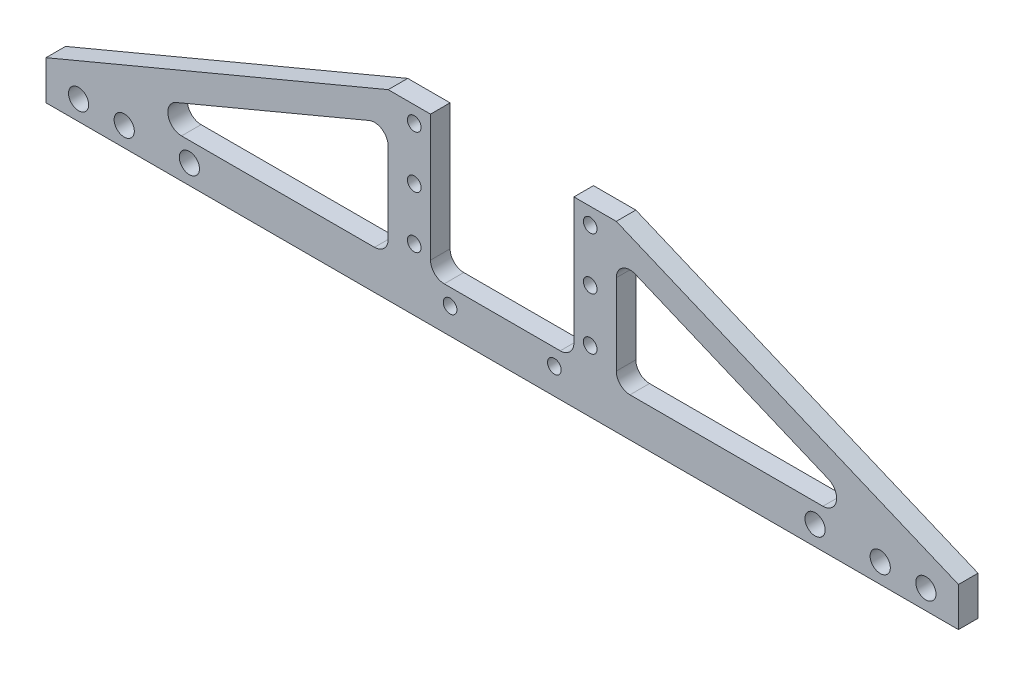
from build123d import *

# Parameters (mm, degrees)
SKETCH_1_R          = 1.05
SKETCH_1_R_2        = 1.55
EXTRUDE_1_DEPTH     = 3
SKETCH_2_R          = 1.55
CUT_EXTRUDE_1_DEPTH = 3


with BuildPart() as part:
    # ｽｹｯﾁ1 → ﾎﾞｽ - 押し出し1 (new body)
    with BuildSketch(Plane.XY):
        with BuildLine():
            Line((-11, 4.6), (-11, 24))
            Line((-11, 24), (-17.5, 24))
            Line((-17.5, 24), (-70, 2))
            Line((-70, 2), (-70, -4))
            Line((-70, -4), (-17.5, -4))
            Line((-17.5, -4), (17.5, -4))
            Line((17.5, -4), (70, -4))
            Line((70, -4), (70, 2))
            Line((70, 2), (17.5, 24))
            Line((17.5, 24), (11, 24))
            Line((11, 24), (11, 4.6))
            ThreePointArc((11, 4.6), (10.38492424, 3.11507576), (8.9, 2.5))
            Line((8.9, 2.5), (-8.9, 2.5))
            ThreePointArc((-8.9, 2.5), (-10.38492424, 3.11507576), (-11, 4.6))
        make_face()
        with Locations((-13.5, 5.5)):
            Circle(SKETCH_1_R, mode=Mode.SUBTRACT)
        with Locations((-8, 0)):
            Circle(SKETCH_1_R, mode=Mode.SUBTRACT)
        with Locations((8, 0)):
            Circle(SKETCH_1_R, mode=Mode.SUBTRACT)
        with Locations((-13.5, 13.5)):
            Circle(SKETCH_1_R, mode=Mode.SUBTRACT)
        with Locations((-13.5, 21.5)):
            Circle(SKETCH_1_R, mode=Mode.SUBTRACT)
        with Locations((13.5, 21.5)):
            Circle(SKETCH_1_R, mode=Mode.SUBTRACT)
        with Locations((13.5, 13.5)):
            Circle(SKETCH_1_R, mode=Mode.SUBTRACT)
        with Locations((13.5, 5.5)):
            Circle(SKETCH_1_R, mode=Mode.SUBTRACT)
        with Locations((-65, -1)):
            Circle(SKETCH_1_R_2, mode=Mode.SUBTRACT)
        with Locations(Location((65, -1, 0), (0, 0, 180))):
            Circle(SKETCH_1_R_2, mode=Mode.SUBTRACT)
        with BuildLine():
            Line((-17.5, 4.1), (-17.5, 16.506066998))
            ThreePointArc((-17.5, 16.506066998), (-18.436901101, 18.254552329), (-20.411619954, 18.442887344))
            Line((-20.411619954, 18.442887344), (-50.017007109, 6.036820345))
            ThreePointArc((-50.017007109, 6.036820345), (-51.264188108, 3.686069284), (-49.205387155, 2))
            Line((-49.205387155, 2), (-19.6, 2))
            ThreePointArc((-19.6, 2), (-18.11507576, 2.61507576), (-17.5, 4.1))
        make_face(mode=Mode.SUBTRACT)
        with BuildLine():
            Line((20.411619954, 18.442887344), (50.017007109, 6.036820345))
            ThreePointArc((50.017007109, 6.036820345), (51.264188108, 3.686069284), (49.205387155, 2))
            Line((49.205387155, 2), (19.6, 2))
            ThreePointArc((19.6, 2), (18.11507576, 2.61507576), (17.5, 4.1))
            Line((17.5, 4.1), (17.5, 16.506066998))
            ThreePointArc((17.5, 16.506066998), (18.436901101, 18.254552329), (20.411619954, 18.442887344))
        make_face(mode=Mode.SUBTRACT)
    extrude(amount=EXTRUDE_1_DEPTH)

    # ｽｹｯﾁ2 → ｶｯﾄ - 押し出し1 (cut)
    with BuildSketch(Plane.XY.offset(3)):
        with Locations((-48, -1)):
            Circle(SKETCH_2_R)
        with Locations(Location((48, -1, 0), (0, 0, 180))):
            Circle(SKETCH_2_R)
        with Locations((-58, -1)):
            Circle(SKETCH_2_R)
        with Locations(Location((58, -1, 0), (0, 0, 180))):
            Circle(SKETCH_2_R)
    extrude(amount=-CUT_EXTRUDE_1_DEPTH, mode=Mode.SUBTRACT)


solid = part.part
